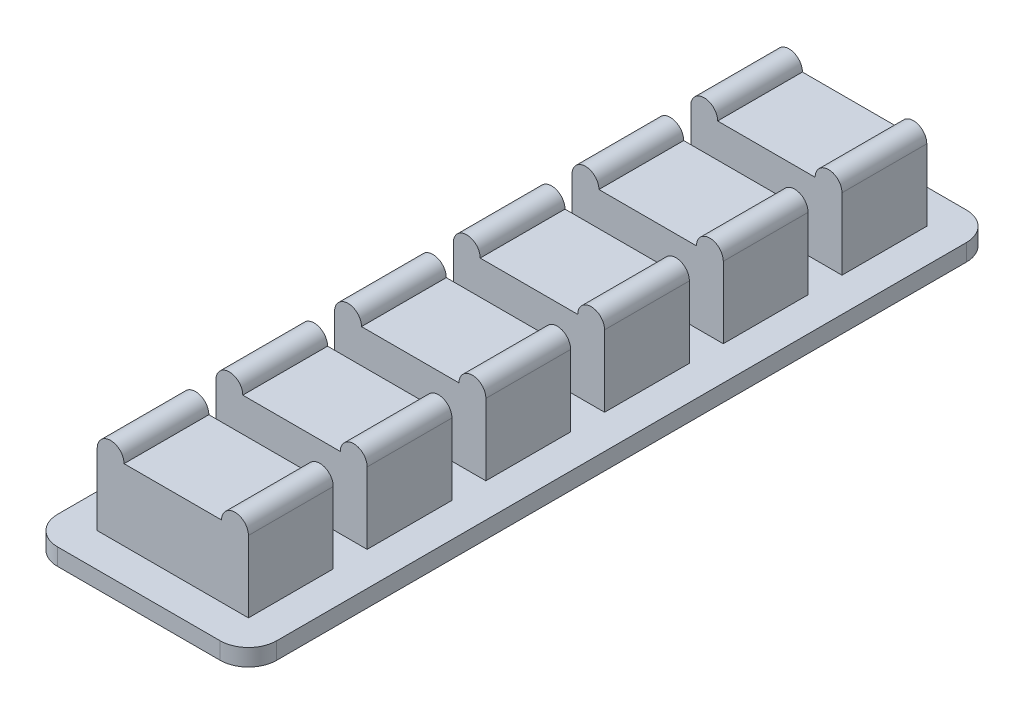
from build123d import *

# Parameters (mm, degrees)
BOSS_EXTRUDE1_DEPTH = 6
SKETCH3_W           = 53.5
SKETCH3_H           = 30
BOSS_EXTRUDE2_DEPTH = 30
SKETCH4_W           = 34.5
SKETCH4_H           = 4.75
CUT_EXTRUDE1_DEPTH  = 240


with BuildPart() as part:
    # Sketch2 → Boss-Extrude1 (new body)
    with BuildSketch(Plane(origin=(0, 0, 0), x_dir=(1, 0, 0), z_dir=(0, 1, 0))):
        with BuildLine():
            Line((10, 0), (67.5, 0))
            ThreePointArc((67.5, 0), (74.571067812, 2.928932188), (77.5, 10))
            Line((77.5, 10), (77.5, 254))
            ThreePointArc((77.5, 254), (74.571067812, 261.071067812), (67.5, 264))
            Line((67.5, 264), (10, 264))
            ThreePointArc((10, 264), (2.928932188, 261.071067812), (0, 254))
            Line((0, 254), (0, 10))
            ThreePointArc((0, 10), (2.928932188, 2.928932188), (10, 0))
        make_face()
    extrude(amount=BOSS_EXTRUDE1_DEPTH)

    # Sketch3 → Boss-Extrude2 (add)
    with BuildSketch(Plane(origin=(0, 6, 0), x_dir=(1, 0, 0), z_dir=(0, 1, 0))):
        with Locations((38.75, 27)):
            Rectangle(SKETCH3_W, SKETCH3_H)
        with Locations((38.75, 69)):
            Rectangle(SKETCH3_W, SKETCH3_H)
        with Locations((38.75, 111)):
            Rectangle(SKETCH3_W, SKETCH3_H)
        with Locations((38.75, 237)):
            Rectangle(SKETCH3_W, SKETCH3_H)
        with Locations((38.75, 195)):
            Rectangle(SKETCH3_W, SKETCH3_H)
        with Locations((38.75, 153)):
            Rectangle(SKETCH3_W, SKETCH3_H)
    extrude(amount=BOSS_EXTRUDE2_DEPTH)

    # Sketch4 → Cut-Extrude1 (cut)
    with BuildSketch(Plane.XY.offset(-12)):
        with BuildLine():
            Line((21.5, 36), (16.75, 36))
            ThreePointArc((16.75, 36), (20.108757211, 34.608757211), (21.5, 31.25))
            Line((21.5, 31.25), (21.5, 36))
        make_face()
        with Locations((38.75, 33.625)):
            Rectangle(SKETCH4_W, SKETCH4_H)
        with BuildLine():
            Line((56, 36), (56, 31.25))
            ThreePointArc((56, 31.25), (57.391242789, 34.608757211), (60.75, 36))
            Line((60.75, 36), (56, 36))
        make_face()
        with BuildLine():
            Line((65.5, 36), (60.75, 36))
            ThreePointArc((60.75, 36), (64.108757211, 34.608757211), (65.5, 31.25))
            Line((65.5, 31.25), (65.5, 36))
        make_face()
        with BuildLine():
            Line((12, 36), (16.75, 36))
            ThreePointArc((16.75, 36), (13.391242789, 34.608757211), (12, 31.25))
            Line((12, 31.25), (12, 36))
        make_face()
    extrude(amount=-CUT_EXTRUDE1_DEPTH, mode=Mode.SUBTRACT)


solid = part.part
